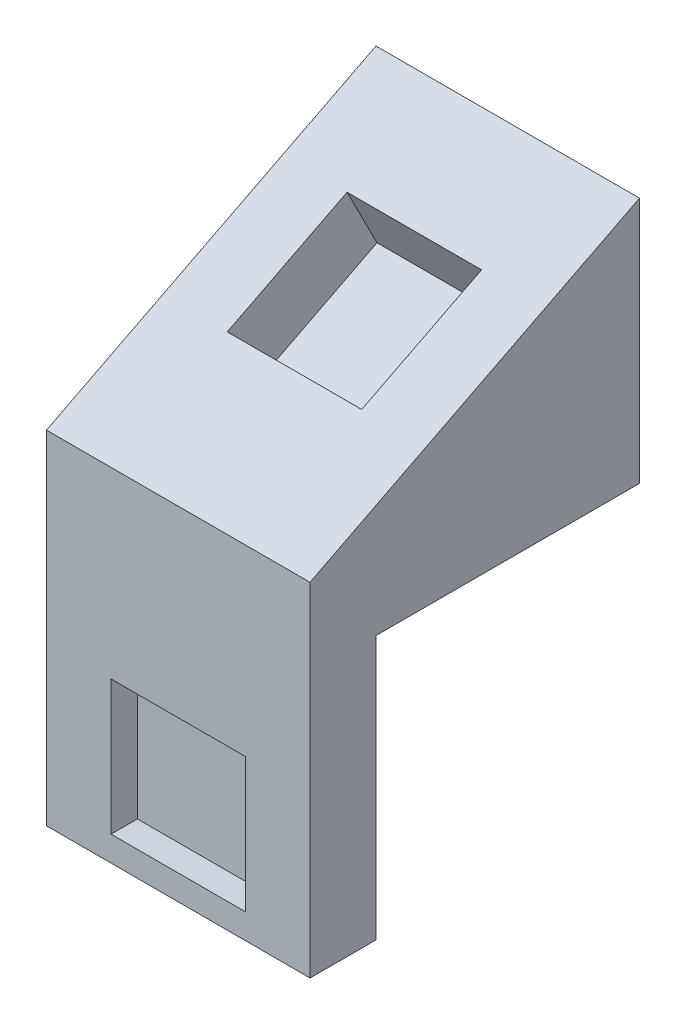
from build123d import *

# Parameters (mm, degrees)
SZKIC1_W                    = 20
SZKIC1_H                    = 26
DODANIE_WYCI_GNI_CIE1_DEPTH = 5
SZKIC2_W                    = 20
SZKIC2_H                    = 6
DODANIE_WYCI_GNI_CIE2_DEPTH = 20
SZKIC3_W                    = 10.2
SZKIC3_H                    = 10.2
WYTNIJ_WYCI_GNI_CIE1_DEPTH  = 2
DODANIE_WYCI_GNI_CIE3_DEPTH = 20
SZKIC5_W                    = 10.2
SZKIC5_H                    = 10.2
WYTNIJ_WYCI_GNI_CIE2_DEPTH  = 5
SZKIC6_R                    = 2
WYTNIJ_WYCI_GNI_CIE3_DEPTH  = 6


with BuildPart() as part:
    # Szkic1 → Dodanie-wyciągnięcie1 (new body)
    with BuildSketch(Plane.XY):
        Rectangle(SZKIC1_W, SZKIC1_H)
    extrude(amount=DODANIE_WYCI_GNI_CIE1_DEPTH)

    # Szkic2 → Dodanie-wyciągnięcie2 (add)
    with BuildSketch(Plane(origin=(0, 0, 0), x_dir=(-1, 0, 0), z_dir=(0, 0, -1))):
        with Locations((0, 10)):
            Rectangle(SZKIC2_W, SZKIC2_H)
    extrude(amount=DODANIE_WYCI_GNI_CIE2_DEPTH)

    # Szkic3 → Wytnij-wyciągnięcie1 (cut)
    with BuildSketch(Plane.XY.offset(5)):
        with Locations((0, -6)):
            Rectangle(SZKIC3_W, SZKIC3_H)
    extrude(amount=-WYTNIJ_WYCI_GNI_CIE1_DEPTH, mode=Mode.SUBTRACT)

    # Szkic4 → Dodanie-wyciągnięcie3 (add)
    with BuildSketch(Plane(origin=(10, 0, 0), x_dir=(0, 0, -1), z_dir=(1, 0, 0))):
        Polygon((-5, 13), (20, 25.738136237), (20, 13), align=None)
    extrude(amount=-DODANIE_WYCI_GNI_CIE3_DEPTH)

    # Szkic5 → Wytnij-wyciągnięcie2 (cut)
    with BuildSketch(Plane(origin=(0, 12.343146626, 6.289147333), x_dir=(1, 0, 0), z_dir=(0, 0.8910065241883706, 0.4539904997395416))):
        with Locations((0, 16.446843876)):
            Rectangle(SZKIC5_W, SZKIC5_H)
    extrude(amount=-WYTNIJ_WYCI_GNI_CIE2_DEPTH, mode=Mode.SUBTRACT)

    # Szkic6 → Wytnij-wyciągnięcie3 (cut)
    with BuildSketch(Plane(origin=(0, 0, -20), x_dir=(-1, 0, 0), z_dir=(0, 0, -1))):
        with Locations((0, 13)):
            Circle(SZKIC6_R)
    extrude(amount=-WYTNIJ_WYCI_GNI_CIE3_DEPTH, mode=Mode.SUBTRACT)


solid = part.part
